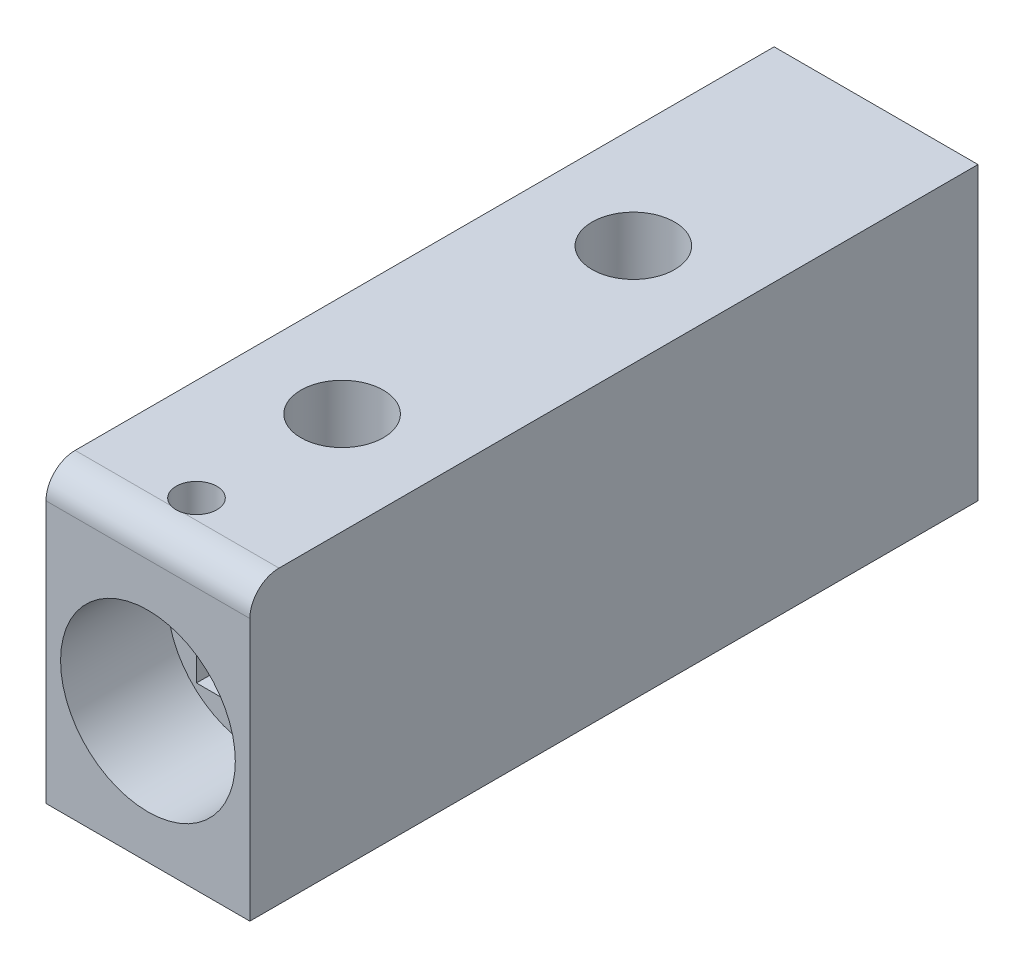
from build123d import *

# Parameters (mm, degrees)
SKETCH_1_W               = 21
SKETCH_1_H               = 30
EXTRUDE_1_DEPTH          = 75
CUT_EXTRUDE_1_DEPTH      = 82.457043894
CUT_EXTRUDE_1_DEPTH_BACK = 11
SKETCH_2_R               = 9
SKETCH_3_W               = 12
SKETCH_3_H               = 12
CUT_EXTRUDE_2_DEPTH      = 72.45802964
FILLET_1_R               = 3
HOLE_WIZARD_M5_1_REACH   = 83.457
HOLE_WIZARD_M5_1_BORE_R  = 2.1
HOLE_WIZARD_M10_1_D      = 8.5
HOLE_WIZARD_M10_1_DEPTH  = 10.5


with BuildPart() as part:
    # 草图1 → 凸台-拉伸1 (new body)
    with BuildSketch(Plane.XY):
        with Locations((0, 15)):
            Rectangle(SKETCH_1_W, SKETCH_1_H)
    extrude(amount=-EXTRUDE_1_DEPTH)

    # 草图2 → 切除-拉伸1 (cut, two sides: drawn at the far end of the back side and taken through both)
    with BuildSketch(Plane.XY.offset(-CUT_EXTRUDE_1_DEPTH_BACK)):
        with Locations(Location((0, 13.5, 0), (0, 0, 180))):
            Circle(SKETCH_2_R)
    extrude(amount=CUT_EXTRUDE_1_DEPTH + CUT_EXTRUDE_1_DEPTH_BACK, mode=Mode.SUBTRACT)

    # 草图3 → 切除-拉伸2 (cut, through all)
    with BuildSketch(Plane.XY.offset(-11)):
        with Locations((0, 13.5)):
            Rectangle(SKETCH_3_W, SKETCH_3_H)
    extrude(amount=-CUT_EXTRUDE_2_DEPTH, mode=Mode.SUBTRACT)

    # 圆角1
    fillet_1_edges = [part.edges().sort_by_distance(p)[0] for p in [
        (0, 30, 0),
    ]]
    fillet(fillet_1_edges, radius=FILLET_1_R)

    # M5 螺纹孔1 bore → M5 螺纹孔1 (cut, up to next)
    with BuildSketch(Plane(origin=(0, 30, 0), x_dir=(1, 0, 0), z_dir=(0, 1, 0)), mode=Mode.PRIVATE) as hole_wizard_m5_1_sk1:
        with Locations((0, 5)):
            Circle(HOLE_WIZARD_M5_1_BORE_R)
    hole_wizard_m5_1_tool1 = extrude(hole_wizard_m5_1_sk1.sketch, amount=-HOLE_WIZARD_M5_1_REACH, mode=Mode.PRIVATE) & part.part
    add(hole_wizard_m5_1_tool1.solids().sort_by_distance((0, 30, -5))[0], mode=Mode.SUBTRACT)

    # M10 螺纹孔1
    with Locations(Plane(origin=(0, 30, 0), x_dir=(1, 0, 0), z_dir=(0, 1, 0))):
        with Locations((0, 20), (0, 50)):
            Hole(HOLE_WIZARD_M10_1_D / 2, depth=HOLE_WIZARD_M10_1_DEPTH)


solid = part.part
